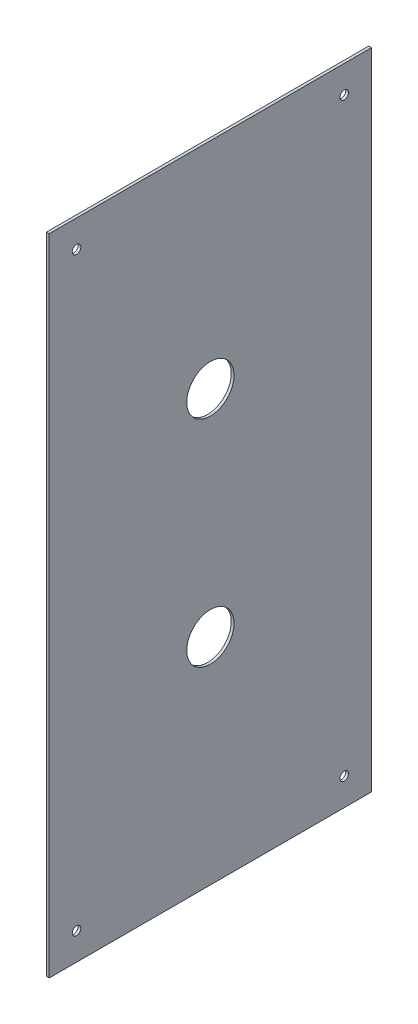
from build123d import *

# Parameters (mm, degrees)
SKETCH1_W                            = 300
SKETCH1_H                            = 150
BOSS_EXTRUDE1_DEPTH                  = 1.3
F_4_0_4_DIAMETER_HOLE1_D             = 4
MIRROR1_AT_THE_SECOND_PLANE_COPY_1_D = 4
F_22_0_22_DIAMETER_HOLE1_D           = 22


with BuildPart() as part:
    # Sketch1 → Boss-Extrude1 (new body)
    with BuildSketch(Plane.YZ):
        Rectangle(SKETCH1_W, SKETCH1_H)
    extrude(amount=BOSS_EXTRUDE1_DEPTH)

    # Ø4.0 (4) Diameter Hole1 (through all)
    with Locations(Plane.YZ.offset(1.3)):
        with Locations((-137.3, 62.3)):
            f_4_0_4_diameter_hole1 = Hole(F_4_0_4_DIAMETER_HOLE1_D / 2)

    # Mirror1: Ø4.0 (4) Diameter Hole1 across plane
    add(f_4_0_4_diameter_hole1.mirror(Plane.ZX), mode=Mode.SUBTRACT)

    # Mirror1 at the second plane: Ø4.0 (4) Diameter Hole1 across plane
    add(f_4_0_4_diameter_hole1.mirror(Plane.XY), mode=Mode.SUBTRACT)

    # Mirror1 at the second plane copy 1 (through all)
    with Locations(Plane(origin=(1.3, 0, 0), x_dir=(0, -1, 0), z_dir=(1, 0, 0))):
        with Locations((-137.3, 62.3)):
            Hole(MIRROR1_AT_THE_SECOND_PLANE_COPY_1_D / 2)

    # Ø22.0 (22) Diameter Hole1 (through all)
    with Locations(Plane.YZ.offset(1.3)):
        with Locations((-50, 0)):
            f_22_0_22_diameter_hole1 = Hole(F_22_0_22_DIAMETER_HOLE1_D / 2)

    # Mirror2: Ø22.0 (22) Diameter Hole1 across plane
    add(f_22_0_22_diameter_hole1.mirror(Plane.ZX), mode=Mode.SUBTRACT)


solid = part.part
